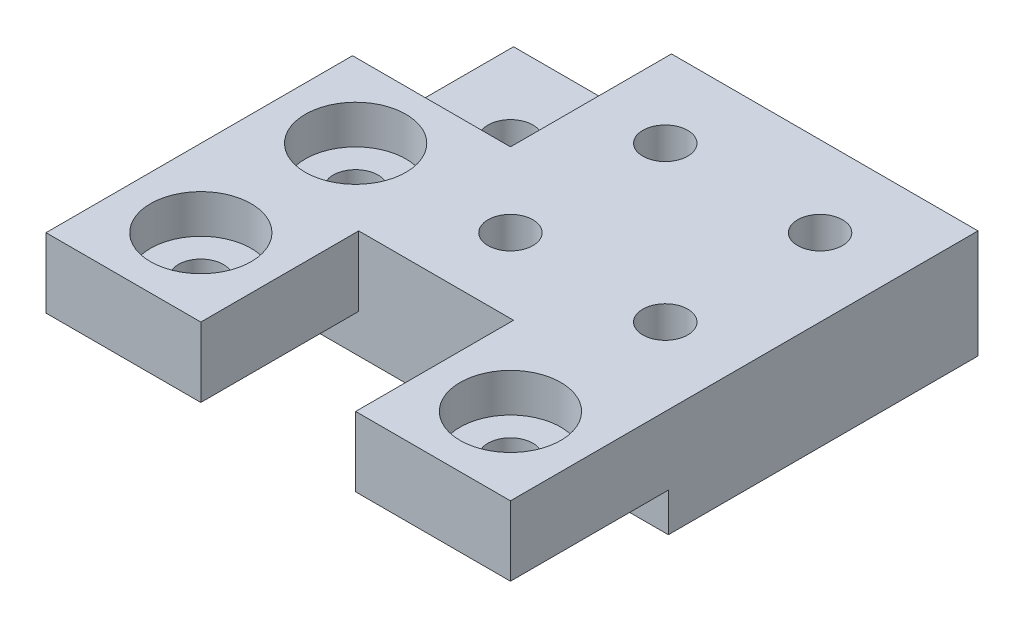
from build123d import *

# Parameters (mm, degrees)
CROQUIS1_W              = 100
CROQUIS1_H              = 100
SALIENTE_EXTRUIR1_DEPTH = 7
CROQUIS2_W              = 10.4
CROQUIS2_H              = 10.4
CORTAR_EXTRUIR1_DEPTH   = 4.7
CROQUIS3_W              = 10
CROQUIS3_H              = 10
SALIENTE_EXTRUIR2_DEPTH = 4.5
CROQUIS4_R              = 1.45
CORTAR_EXTRUIR2_DEPTH   = 7
CROQUIS5_R              = 3.25
CORTAR_EXTRUIR4_DEPTH   = 2.5
CROQUIS6_W              = 10
CROQUIS6_H              = 0.2
CROQUIS6_W_2            = 0.2
CROQUIS6_H_2            = 9.8
CORTAR_EXTRUIR5_DEPTH   = 7
CROQUIS8_W              = 10.2
CROQUIS8_H              = 10
CORTAR_EXTRUIR7_DEPTH   = 7
CROQUIS9_W              = 10.012239445
CROQUIS9_H              = 0.2
CROQUIS9_W_2            = 0.2
CROQUIS9_H_2            = 10.2
CORTAR_EXTRUIR9_DEPTH   = 2.5
CROQUIS10_W             = 0.2
CROQUIS10_H             = 0.2
CORTAR_EXTRUIR11_DEPTH  = 5
CORTAR_EXTRUIR13_DEPTH  = 15


with BuildPart() as part:
    # Croquis1 → Saliente-Extruir1 (new body)
    with BuildSketch(Plane(origin=(0, 0, 0), x_dir=(1, 0, 0), z_dir=(0, 1, 0))):
        Rectangle(CROQUIS1_W, CROQUIS1_H)
    extrude(amount=SALIENTE_EXTRUIR1_DEPTH)

    # Croquis2 → Cortar-Extruir1 (cut)
    with BuildSketch(Plane(origin=(0, 7, 0), x_dir=(1, 0, 0), z_dir=(0, 1, 0))):
        with Locations((-45, 45)):
            Rectangle(CROQUIS2_W, CROQUIS2_H)
        with Locations((-25, 45)):
            Rectangle(CROQUIS2_W, CROQUIS2_H)
        with Locations((-5, 45)):
            Rectangle(CROQUIS2_W, CROQUIS2_H)
        with Locations((15, 45)):
            Rectangle(CROQUIS2_W, CROQUIS2_H)
        with Locations((35, 45)):
            Rectangle(CROQUIS2_W, CROQUIS2_H)
        with Locations((-45, 25)):
            Rectangle(CROQUIS2_W, CROQUIS2_H)
        with Locations((-45, 5)):
            Rectangle(CROQUIS2_W, CROQUIS2_H)
        with Locations((-45, -15)):
            Rectangle(CROQUIS2_W, CROQUIS2_H)
        with Locations((-45, -35)):
            Rectangle(CROQUIS2_W, CROQUIS2_H)
    extrude(amount=-CORTAR_EXTRUIR1_DEPTH, mode=Mode.SUBTRACT)

    # Croquis3 → Saliente-Extruir2 (add)
    with BuildSketch(Plane(origin=(0, 7, 0), x_dir=(1, 0, 0), z_dir=(0, 1, 0))):
        with Locations((55, 25)):
            Rectangle(CROQUIS3_W, CROQUIS3_H)
        with Locations((55, 45)):
            Rectangle(CROQUIS3_W, CROQUIS3_H)
        with Locations((55, 5)):
            Rectangle(CROQUIS3_W, CROQUIS3_H)
        with Locations((55, -15)):
            Rectangle(CROQUIS3_W, CROQUIS3_H)
        with Locations((55, -35)):
            Rectangle(CROQUIS3_W, CROQUIS3_H)
        with Locations((-25, -55)):
            Rectangle(CROQUIS3_W, CROQUIS3_H)
        with Locations((-45, -55)):
            Rectangle(CROQUIS3_W, CROQUIS3_H)
        with Locations((-5, -55)):
            Rectangle(CROQUIS3_W, CROQUIS3_H)
        with Locations((15, -55)):
            Rectangle(CROQUIS3_W, CROQUIS3_H)
        with Locations((35, -55)):
            Rectangle(CROQUIS3_W, CROQUIS3_H)
    extrude(amount=-SALIENTE_EXTRUIR2_DEPTH)

    # Croquis4 → Cortar-Extruir2 (cut)
    with BuildSketch(Plane(origin=(0, 7, 0), x_dir=(1, 0, 0), z_dir=(0, 1, 0))):
        with Locations(Location((-45, 45, 0), (0, 0, 270))):
            Circle(CROQUIS4_R)
        with Locations(Location((-35, 45, 0), (0, 0, 270))):
            Circle(CROQUIS4_R)
        with Locations(Location((-25, 45, 0), (0, 0, 270))):
            Circle(CROQUIS4_R)
        with Locations(Location((-15, 45, 0), (0, 0, 270))):
            Circle(CROQUIS4_R)
        with Locations(Location((-5, 45, 0), (0, 0, 270))):
            Circle(CROQUIS4_R)
        with Locations(Location((5, 45, 0), (0, 0, 270))):
            Circle(CROQUIS4_R)
        with Locations(Location((15, 45, 0), (0, 0, 270))):
            Circle(CROQUIS4_R)
        with Locations(Location((25, 45, 0), (0, 0, 270))):
            Circle(CROQUIS4_R)
        with Locations(Location((35, 45, 0), (0, 0, 270))):
            Circle(CROQUIS4_R)
        with Locations(Location((45, 45, 0), (0, 0, 270))):
            Circle(CROQUIS4_R)
        with Locations(Location((55, 45, 0), (0, 0, 270))):
            Circle(CROQUIS4_R)
        with Locations(Location((-35, 35, 0), (0, 0, 270))):
            Circle(CROQUIS4_R)
        with Locations(Location((-25, 35, 0), (0, 0, 270))):
            Circle(CROQUIS4_R)
        with Locations(Location((-15, 35, 0), (0, 0, 270))):
            Circle(CROQUIS4_R)
        with Locations(Location((-5, 35, 0), (0, 0, 270))):
            Circle(CROQUIS4_R)
        with Locations(Location((5, 35, 0), (0, 0, 270))):
            Circle(CROQUIS4_R)
        with Locations(Location((15, 35, 0), (0, 0, 270))):
            Circle(CROQUIS4_R)
        with Locations(Location((25, 35, 0), (0, 0, 270))):
            Circle(CROQUIS4_R)
        with Locations(Location((35, 35, 0), (0, 0, 270))):
            Circle(CROQUIS4_R)
        with Locations(Location((45, 35, 0), (0, 0, 270))):
            Circle(CROQUIS4_R)
        with Locations((55, 35)):
            Circle(CROQUIS4_R)
        with Locations(Location((-35, 25, 0), (0, 0, 270))):
            Circle(CROQUIS4_R)
        with Locations(Location((-25, 25, 0), (0, 0, 270))):
            Circle(CROQUIS4_R)
        with Locations(Location((-15, 25, 0), (0, 0, 270))):
            Circle(CROQUIS4_R)
        with Locations(Location((-5, 25, 0), (0, 0, 270))):
            Circle(CROQUIS4_R)
        with Locations(Location((5, 25, 0), (0, 0, 270))):
            Circle(CROQUIS4_R)
        with Locations(Location((15, 25, 0), (0, 0, 270))):
            Circle(CROQUIS4_R)
        with Locations(Location((25, 25, 0), (0, 0, 270))):
            Circle(CROQUIS4_R)
        with Locations(Location((35, 25, 0), (0, 0, 270))):
            Circle(CROQUIS4_R)
        with Locations(Location((45, 25, 0), (0, 0, 270))):
            Circle(CROQUIS4_R)
        with Locations(Location((55, 25, 0), (0, 0, 270))):
            Circle(CROQUIS4_R)
        with Locations(Location((-35, 15, 0), (0, 0, 270))):
            Circle(CROQUIS4_R)
        with Locations(Location((-25, 15, 0), (0, 0, 270))):
            Circle(CROQUIS4_R)
        with Locations(Location((-15, 15, 0), (0, 0, 270))):
            Circle(CROQUIS4_R)
        with Locations(Location((-5, 15, 0), (0, 0, 270))):
            Circle(CROQUIS4_R)
        with Locations(Location((5, 15, 0), (0, 0, 270))):
            Circle(CROQUIS4_R)
        with Locations(Location((15, 15, 0), (0, 0, 270))):
            Circle(CROQUIS4_R)
        with Locations(Location((25, 15, 0), (0, 0, 270))):
            Circle(CROQUIS4_R)
        with Locations(Location((35, 15, 0), (0, 0, 270))):
            Circle(CROQUIS4_R)
        with Locations(Location((45, 15, 0), (0, 0, 270))):
            Circle(CROQUIS4_R)
        with Locations((55, 15)):
            Circle(CROQUIS4_R)
        with Locations(Location((-35, 5, 0), (0, 0, 270))):
            Circle(CROQUIS4_R)
        with Locations(Location((-25, 5, 0), (0, 0, 270))):
            Circle(CROQUIS4_R)
        with Locations(Location((-15, 5, 0), (0, 0, 270))):
            Circle(CROQUIS4_R)
        with Locations(Location((-5, 5, 0), (0, 0, 270))):
            Circle(CROQUIS4_R)
        with Locations(Location((5, 5, 0), (0, 0, 270))):
            Circle(CROQUIS4_R)
        with Locations(Location((15, 5, 0), (0, 0, 270))):
            Circle(CROQUIS4_R)
        with Locations(Location((25, 5, 0), (0, 0, 270))):
            Circle(CROQUIS4_R)
        with Locations(Location((35, 5, 0), (0, 0, 270))):
            Circle(CROQUIS4_R)
        with Locations(Location((45, 5, 0), (0, 0, 270))):
            Circle(CROQUIS4_R)
        with Locations(Location((55, 5, 0), (0, 0, 270))):
            Circle(CROQUIS4_R)
        with Locations(Location((-35, -5, 0), (0, 0, 270))):
            Circle(CROQUIS4_R)
        with Locations(Location((-25, -5, 0), (0, 0, 270))):
            Circle(CROQUIS4_R)
        with Locations(Location((-15, -5, 0), (0, 0, 270))):
            Circle(CROQUIS4_R)
        with Locations(Location((-5, -5, 0), (0, 0, 270))):
            Circle(CROQUIS4_R)
        with Locations(Location((5, -5, 0), (0, 0, 270))):
            Circle(CROQUIS4_R)
        with Locations(Location((15, -5, 0), (0, 0, 270))):
            Circle(CROQUIS4_R)
        with Locations(Location((25, -5, 0), (0, 0, 270))):
            Circle(CROQUIS4_R)
        with Locations(Location((35, -5, 0), (0, 0, 270))):
            Circle(CROQUIS4_R)
        with Locations(Location((45, -5, 0), (0, 0, 270))):
            Circle(CROQUIS4_R)
        with Locations((55, -5)):
            Circle(CROQUIS4_R)
        with Locations(Location((-35, -15, 0), (0, 0, 270))):
            Circle(CROQUIS4_R)
        with Locations(Location((-25, -15, 0), (0, 0, 270))):
            Circle(CROQUIS4_R)
        with Locations(Location((-15, -15, 0), (0, 0, 270))):
            Circle(CROQUIS4_R)
        with Locations(Location((-5, -15, 0), (0, 0, 270))):
            Circle(CROQUIS4_R)
        with Locations(Location((5, -15, 0), (0, 0, 270))):
            Circle(CROQUIS4_R)
        with Locations(Location((15, -15, 0), (0, 0, 270))):
            Circle(CROQUIS4_R)
        with Locations(Location((25, -15, 0), (0, 0, 270))):
            Circle(CROQUIS4_R)
        with Locations(Location((35, -15, 0), (0, 0, 270))):
            Circle(CROQUIS4_R)
        with Locations(Location((45, -15, 0), (0, 0, 270))):
            Circle(CROQUIS4_R)
        with Locations(Location((55, -15, 0), (0, 0, 270))):
            Circle(CROQUIS4_R)
        with Locations(Location((-35, -25, 0), (0, 0, 270))):
            Circle(CROQUIS4_R)
        with Locations(Location((-25, -25, 0), (0, 0, 270))):
            Circle(CROQUIS4_R)
        with Locations(Location((-15, -25, 0), (0, 0, 270))):
            Circle(CROQUIS4_R)
        with Locations(Location((-5, -25, 0), (0, 0, 270))):
            Circle(CROQUIS4_R)
        with Locations(Location((5, -25, 0), (0, 0, 270))):
            Circle(CROQUIS4_R)
        with Locations(Location((15, -25, 0), (0, 0, 270))):
            Circle(CROQUIS4_R)
        with Locations(Location((25, -25, 0), (0, 0, 270))):
            Circle(CROQUIS4_R)
        with Locations(Location((35, -25, 0), (0, 0, 270))):
            Circle(CROQUIS4_R)
        with Locations(Location((45, -25, 0), (0, 0, 270))):
            Circle(CROQUIS4_R)
        with Locations((55, -25)):
            Circle(CROQUIS4_R)
        with Locations(Location((-35, -35, 0), (0, 0, 270))):
            Circle(CROQUIS4_R)
        with Locations(Location((-25, -35, 0), (0, 0, 270))):
            Circle(CROQUIS4_R)
        with Locations(Location((-15, -35, 0), (0, 0, 270))):
            Circle(CROQUIS4_R)
        with Locations(Location((-5, -35, 0), (0, 0, 270))):
            Circle(CROQUIS4_R)
        with Locations(Location((5, -35, 0), (0, 0, 270))):
            Circle(CROQUIS4_R)
        with Locations(Location((15, -35, 0), (0, 0, 270))):
            Circle(CROQUIS4_R)
        with Locations(Location((25, -35, 0), (0, 0, 270))):
            Circle(CROQUIS4_R)
        with Locations(Location((35, -35, 0), (0, 0, 270))):
            Circle(CROQUIS4_R)
        with Locations(Location((45, -35, 0), (0, 0, 270))):
            Circle(CROQUIS4_R)
        with Locations(Location((55, -35, 0), (0, 0, 270))):
            Circle(CROQUIS4_R)
        with Locations(Location((-35, -45, 0), (0, 0, 270))):
            Circle(CROQUIS4_R)
        with Locations(Location((-25, -45, 0), (0, 0, 270))):
            Circle(CROQUIS4_R)
        with Locations(Location((-15, -45, 0), (0, 0, 270))):
            Circle(CROQUIS4_R)
        with Locations(Location((-5, -45, 0), (0, 0, 270))):
            Circle(CROQUIS4_R)
        with Locations(Location((5, -45, 0), (0, 0, 270))):
            Circle(CROQUIS4_R)
        with Locations(Location((15, -45, 0), (0, 0, 270))):
            Circle(CROQUIS4_R)
        with Locations(Location((25, -45, 0), (0, 0, 270))):
            Circle(CROQUIS4_R)
        with Locations(Location((35, -45, 0), (0, 0, 270))):
            Circle(CROQUIS4_R)
        with Locations(Location((45, -45, 0), (0, 0, 270))):
            Circle(CROQUIS4_R)
        with Locations((55, -45)):
            Circle(CROQUIS4_R)
        with Locations((-35, -55)):
            Circle(CROQUIS4_R)
        with Locations(Location((-25, -55, 0), (0, 0, 270))):
            Circle(CROQUIS4_R)
        with Locations((-15, -55)):
            Circle(CROQUIS4_R)
        with Locations(Location((-5, -55, 0), (0, 0, 270))):
            Circle(CROQUIS4_R)
        with Locations((5, -55)):
            Circle(CROQUIS4_R)
        with Locations(Location((15, -55, 0), (0, 0, 270))):
            Circle(CROQUIS4_R)
        with Locations((25, -55)):
            Circle(CROQUIS4_R)
        with Locations(Location((35, -55, 0), (0, 0, 270))):
            Circle(CROQUIS4_R)
        with Locations((45, -55)):
            Circle(CROQUIS4_R)
        with Locations((55, -55)):
            Circle(CROQUIS4_R)
        with Locations(Location((-45, 35, 0), (0, 0, 270))):
            Circle(CROQUIS4_R)
        with Locations(Location((-45, 25, 0), (0, 0, 270))):
            Circle(CROQUIS4_R)
        with Locations(Location((-45, 15, 0), (0, 0, 270))):
            Circle(CROQUIS4_R)
        with Locations(Location((-45, 5, 0), (0, 0, 270))):
            Circle(CROQUIS4_R)
        with Locations(Location((-45, -5, 0), (0, 0, 270))):
            Circle(CROQUIS4_R)
        with Locations(Location((-45, -15, 0), (0, 0, 270))):
            Circle(CROQUIS4_R)
        with Locations(Location((-45, -25, 0), (0, 0, 270))):
            Circle(CROQUIS4_R)
        with Locations(Location((-45, -35, 0), (0, 0, 270))):
            Circle(CROQUIS4_R)
        with Locations(Location((-45, -45, 0), (0, 0, 270))):
            Circle(CROQUIS4_R)
        with Locations(Location((-45, -55, 0), (0, 0, 270))):
            Circle(CROQUIS4_R)
    extrude(amount=-CORTAR_EXTRUIR2_DEPTH, mode=Mode.SUBTRACT)

    # Croquis5 → Cortar-Extruir4 (cut)
    with BuildSketch(Plane(origin=(0, 7, 0), x_dir=(1, 0, 0), z_dir=(0, 1, 0))):
        with Locations((-45, 45)):
            Circle(CROQUIS5_R)
        with Locations(Location((-35, 45, 0), (0, 0, 270))):
            Circle(CROQUIS5_R)
        with Locations((-25, 45)):
            Circle(CROQUIS5_R)
        with Locations(Location((-15, 45, 0), (0, 0, 270))):
            Circle(CROQUIS5_R)
        with Locations((-5, 45)):
            Circle(CROQUIS5_R)
        with Locations(Location((5, 45, 0), (0, 0, 270))):
            Circle(CROQUIS5_R)
        with Locations((15, 45)):
            Circle(CROQUIS5_R)
        with Locations(Location((25, 45, 0), (0, 0, 270))):
            Circle(CROQUIS5_R)
        with Locations((35, 45)):
            Circle(CROQUIS5_R)
        with Locations(Location((45, 45, 0), (0, 0, 270))):
            Circle(CROQUIS5_R)
        with Locations(Location((55, 45, 0), (0, 0, 270))):
            Circle(CROQUIS5_R)
        with Locations((55, 35)):
            Circle(CROQUIS5_R)
        with Locations(Location((55, 25, 0), (0, 0, 270))):
            Circle(CROQUIS5_R)
        with Locations((55, 15)):
            Circle(CROQUIS5_R)
        with Locations(Location((55, 5, 0), (0, 0, 270))):
            Circle(CROQUIS5_R)
        with Locations((55, -5)):
            Circle(CROQUIS5_R)
        with Locations(Location((55, -15, 0), (0, 0, 270))):
            Circle(CROQUIS5_R)
        with Locations((55, -25)):
            Circle(CROQUIS5_R)
        with Locations(Location((55, -35, 0), (0, 0, 270))):
            Circle(CROQUIS5_R)
        with Locations((55, -45)):
            Circle(CROQUIS5_R)
        with Locations((-35, -55)):
            Circle(CROQUIS5_R)
        with Locations(Location((-25, -55, 0), (0, 0, 270))):
            Circle(CROQUIS5_R)
        with Locations((-15, -55)):
            Circle(CROQUIS5_R)
        with Locations(Location((-5, -55, 0), (0, 0, 270))):
            Circle(CROQUIS5_R)
        with Locations((5, -55)):
            Circle(CROQUIS5_R)
        with Locations(Location((15, -55, 0), (0, 0, 270))):
            Circle(CROQUIS5_R)
        with Locations((25, -55)):
            Circle(CROQUIS5_R)
        with Locations(Location((35, -55, 0), (0, 0, 270))):
            Circle(CROQUIS5_R)
        with Locations((45, -55)):
            Circle(CROQUIS5_R)
        with Locations((55, -55)):
            Circle(CROQUIS5_R)
        with Locations(Location((-45, 35, 0), (0, 0, 270))):
            Circle(CROQUIS5_R)
        with Locations((-45, 25)):
            Circle(CROQUIS5_R)
        with Locations(Location((-45, 15, 0), (0, 0, 270))):
            Circle(CROQUIS5_R)
        with Locations((-45, 5)):
            Circle(CROQUIS5_R)
        with Locations(Location((-45, -5, 0), (0, 0, 270))):
            Circle(CROQUIS5_R)
        with Locations((-45, -15)):
            Circle(CROQUIS5_R)
        with Locations(Location((-45, -25, 0), (0, 0, 270))):
            Circle(CROQUIS5_R)
        with Locations((-45, -35)):
            Circle(CROQUIS5_R)
        with Locations(Location((-45, -45, 0), (0, 0, 270))):
            Circle(CROQUIS5_R)
        with Locations(Location((-45, -55, 0), (0, 0, 270))):
            Circle(CROQUIS5_R)
    extrude(amount=-CORTAR_EXTRUIR4_DEPTH, mode=Mode.SUBTRACT)

    # Croquis6 → Cortar-Extruir5 (cut)
    with BuildSketch(Plane(origin=(0, 7, 0), x_dir=(1, 0, 0), z_dir=(0, 1, 0))):
        Polygon((50, -50), (40, -50), (40, -49.8), (49.8, -49.8), (49.8, -40), (50, -40), (50, -49.8), align=None)
        with Locations((25, -49.9)):
            Rectangle(CROQUIS6_W, CROQUIS6_H)
        with Locations((5, -49.9)):
            Rectangle(CROQUIS6_W, CROQUIS6_H)
        with Locations((-15, -49.9)):
            Rectangle(CROQUIS6_W, CROQUIS6_H)
        with Locations((-35, -49.9)):
            Rectangle(CROQUIS6_W, CROQUIS6_H)
        with Locations((49.9, -24.9)):
            Rectangle(CROQUIS6_W_2, CROQUIS6_H_2)
        with Locations((49.9, -4.9)):
            Rectangle(CROQUIS6_W_2, CROQUIS6_H_2)
        with Locations((49.9, 15.1)):
            Rectangle(CROQUIS6_W_2, CROQUIS6_H_2)
        with Locations((49.9, 35.1)):
            Rectangle(CROQUIS6_W_2, CROQUIS6_H_2)
    extrude(amount=-CORTAR_EXTRUIR5_DEPTH, mode=Mode.SUBTRACT)

    # Croquis8 → Cortar-Extruir7 (cut)
    with BuildSketch(Plane(origin=(0, 7, 0), x_dir=(1, 0, 0), z_dir=(0, 1, 0))):
        with Locations((54.9, 45)):
            Rectangle(CROQUIS8_W, CROQUIS8_H)
    extrude(amount=-CORTAR_EXTRUIR7_DEPTH, mode=Mode.SUBTRACT)

    # Croquis9 → Cortar-Extruir9 (cut)
    with BuildSketch(Plane.XZ):
        with Locations((-45.006119723, 49.9)):
            Rectangle(CROQUIS9_W, CROQUIS9_H)
        with Locations((-25.006119723, 49.9)):
            Rectangle(CROQUIS9_W, CROQUIS9_H)
        with Locations((-5.006119723, 49.9)):
            Rectangle(CROQUIS9_W, CROQUIS9_H)
        with Locations((14.993880278, 49.9)):
            Rectangle(CROQUIS9_W, CROQUIS9_H)
        with Locations((34.993880277, 49.9)):
            Rectangle(CROQUIS9_W, CROQUIS9_H)
        with Locations((49.9, -25.1)):
            Rectangle(CROQUIS9_W_2, CROQUIS9_H_2)
        with Locations((49.9, -5.1)):
            Rectangle(CROQUIS9_W_2, CROQUIS9_H_2)
        with Locations((49.9, 14.9)):
            Rectangle(CROQUIS9_W_2, CROQUIS9_H_2)
        with Locations((49.9, 34.9)):
            Rectangle(CROQUIS9_W_2, CROQUIS9_H_2)
    extrude(amount=-CORTAR_EXTRUIR9_DEPTH, mode=Mode.SUBTRACT)

    # Croquis10 → Cortar-Extruir11 (cut)
    with BuildSketch(Plane.XZ.offset(-2.5)):
        with Locations((49.9, 29.9)):
            Rectangle(CROQUIS10_W, CROQUIS10_H)
        with Locations((49.9, 9.9)):
            Rectangle(CROQUIS10_W, CROQUIS10_H)
        with Locations((49.9, -10.1)):
            Rectangle(CROQUIS10_W, CROQUIS10_H)
        with Locations((49.9, -30.1)):
            Rectangle(CROQUIS10_W, CROQUIS10_H)
    extrude(amount=-CORTAR_EXTRUIR11_DEPTH, mode=Mode.SUBTRACT)

    # Croquis11 → Cortar-Extruir13 (cut)
    with BuildSketch(Plane(origin=(0, 7, 0), x_dir=(1, 0, 0), z_dir=(0, 1, 0))):
        Polygon((-50, -29.8), (-20, -29.8), (-20, -60), (69.821086469, -60), (69.821086469, -29.8), (69.821086469, 55.315062569), (-50, 55.315062569), align=None)
    extrude(amount=-CORTAR_EXTRUIR13_DEPTH, mode=Mode.SUBTRACT)


solid = part.part
